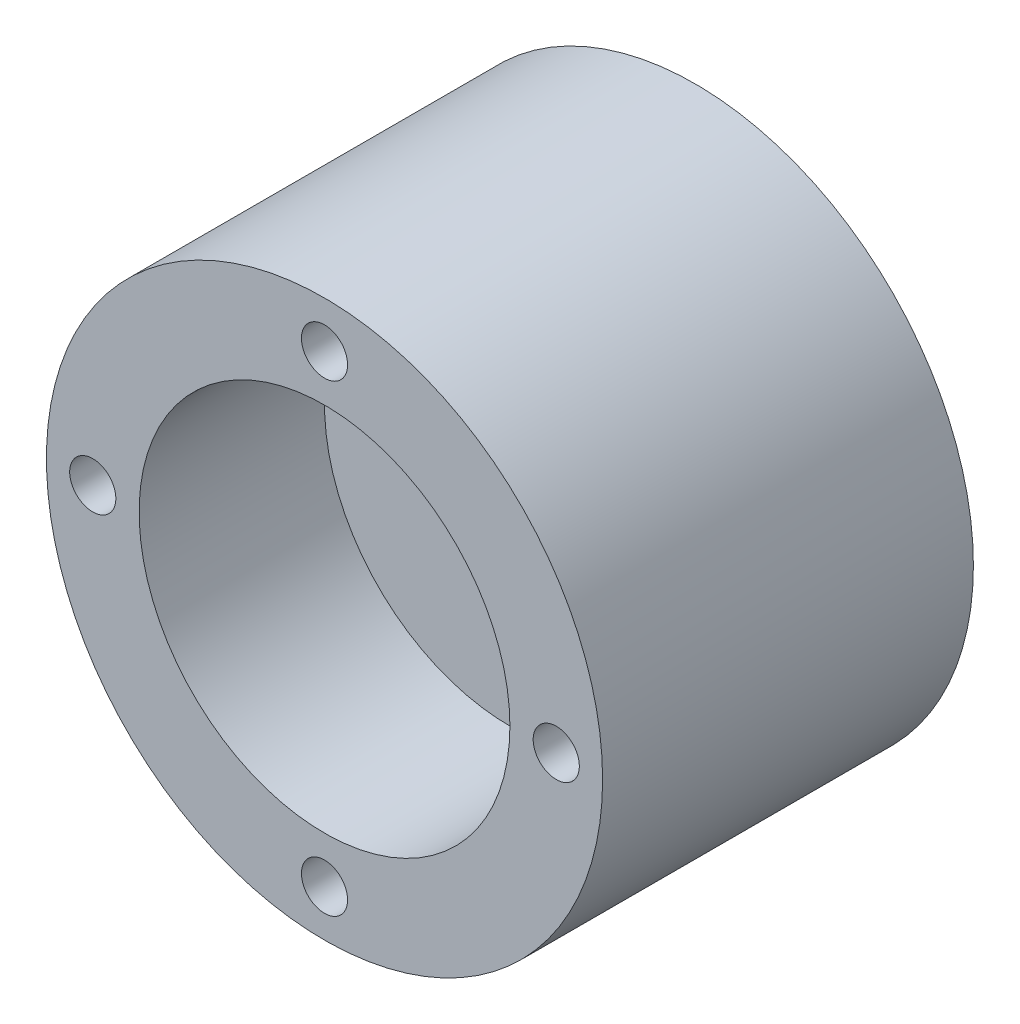
from build123d import *

# Parameters (mm, degrees)
SKETCH1_R           = 38.1
BOSS_EXTRUDE1_DEPTH = 50.8
SKETCH2_R           = 7.9375
SKETCH2_R_2         = 3.1623
CUT_EXTRUDE1_DEPTH  = 50.8
SKETCH3_R           = 25.4
CUT_EXTRUDE2_DEPTH  = 25.4


with BuildPart() as part:
    # Sketch1 → Boss-Extrude1 (new body)
    with BuildSketch(Plane.XY):
        Circle(SKETCH1_R)
    extrude(amount=BOSS_EXTRUDE1_DEPTH)

    # Sketch2 → Cut-Extrude1 (cut)
    with BuildSketch(Plane.XY.offset(50.8)):
        Circle(SKETCH2_R)
        with Locations((0, 31.75)):
            Circle(SKETCH2_R_2)
        with Locations((0, -31.75)):
            Circle(SKETCH2_R_2)
        with Locations((31.75, 0)):
            Circle(SKETCH2_R_2)
        with Locations((-31.75, 0)):
            Circle(SKETCH2_R_2)
    extrude(amount=-CUT_EXTRUDE1_DEPTH, mode=Mode.SUBTRACT)

    # Sketch3 → Cut-Extrude2 (cut)
    with BuildSketch(Plane.XY.offset(50.8)):
        Circle(SKETCH3_R)
    extrude(amount=-CUT_EXTRUDE2_DEPTH, mode=Mode.SUBTRACT)


solid = part.part
